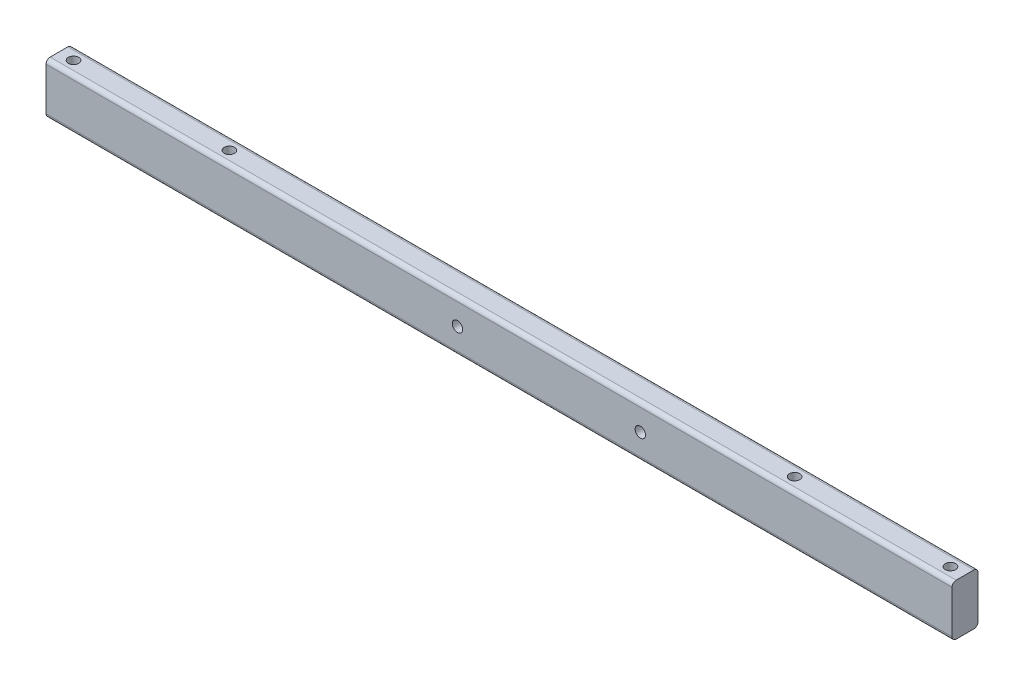
from build123d import *

# Parameters (mm, degrees)
SKETCH1_W           = 218
SKETCH1_H           = 12.3
SKETCH1_R           = 1.25
BOSS_EXTRUDE1_DEPTH = 6.25
SKETCH2_R           = 1.25
CUT_EXTRUDE1_DEPTH  = 8
FILLET1_R           = 1


with BuildPart() as part:
    # Sketch1 → Boss-Extrude1 (new body)
    with BuildSketch(Plane.XY):
        with Locations((109, 6.15)):
            Rectangle(SKETCH1_W, SKETCH1_H)
        with Locations((143, 6.15)):
            Circle(SKETCH1_R, mode=Mode.SUBTRACT)
        with Locations((99, 6.15)):
            Circle(SKETCH1_R, mode=Mode.SUBTRACT)
    extrude(amount=BOSS_EXTRUDE1_DEPTH)

    # Sketch2 → Cut-Extrude1 (cut)
    with BuildSketch(Plane(origin=(0, 12.3, 0), x_dir=(1, 0, 0), z_dir=(0, 1, 0))):
        with Locations(Location((214.5, -3.125, 0), (0, 0, 270))):
            Circle(SKETCH2_R)
        with Locations(Location((177, -3.125, 0), (0, 0, 270))):
            Circle(SKETCH2_R)
        with Locations(Location((3.5, -3.125, 0), (0, 0, 90))):
            Circle(SKETCH2_R)
        with Locations(Location((41, -3.125, 0), (0, 0, 90))):
            Circle(SKETCH2_R)
    extrude(amount=-CUT_EXTRUDE1_DEPTH, mode=Mode.SUBTRACT)

    # Fillet1
    fillet1_edges = [part.edges().sort_by_distance(p)[0] for p in [
        (109, 12.3, 6.25),
        (109, 12.3, 0),
        (109, 0, 0),
        (109, 0, 6.25),
    ]]
    fillet(fillet1_edges, radius=FILLET1_R)


with BuildPart() as part_1:
    # Body-Move/Copy1: moved
    add(part.part.moved(Location((0, 5e-08, 6.25))))


solid = part_1.part
